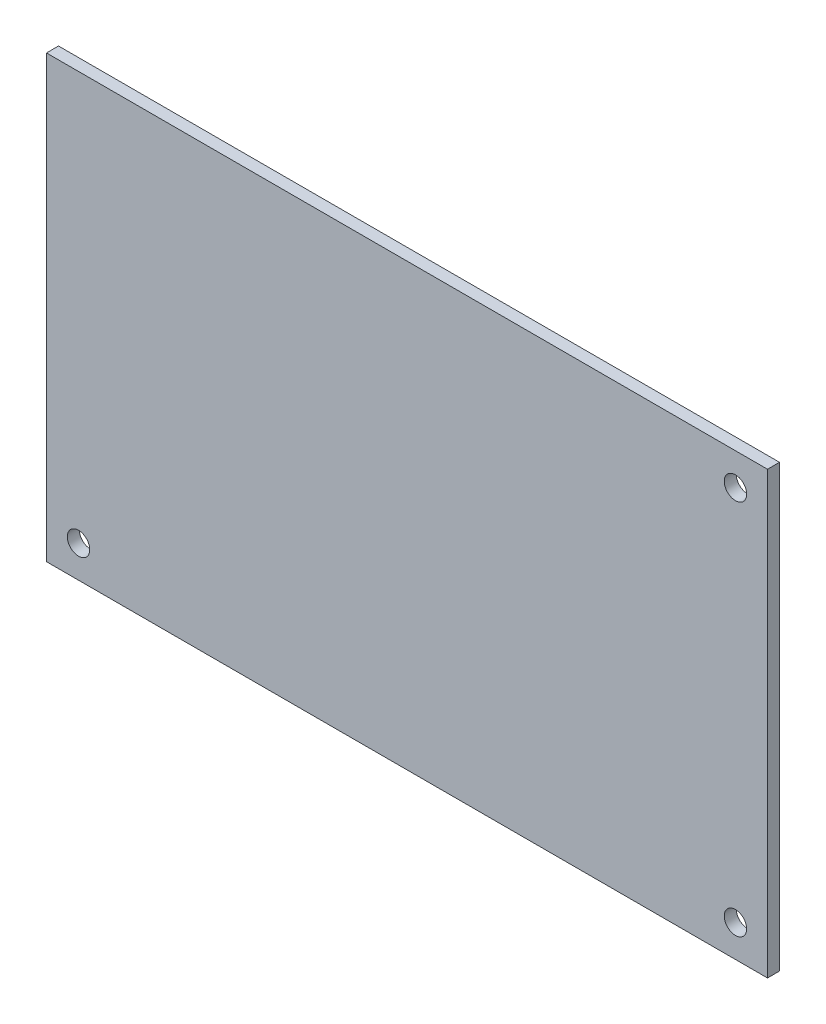
from build123d import *

# Parameters (mm, degrees)
SKETCH_1_W          = 90
SKETCH_1_H          = 55
EXTRUDE_1_DEPTH     = 1.5
SKETCH_2_R          = 1.4
CUT_EXTRUDE_1_DEPTH = 1.5


with BuildPart() as part:
    # ｽｹｯﾁ1 → ﾎﾞｽ - 押し出し1 (new body)
    with BuildSketch(Plane.XY):
        Rectangle(SKETCH_1_W, SKETCH_1_H)
    extrude(amount=EXTRUDE_1_DEPTH)

    # ｽｹｯﾁ2 → ｶｯﾄ - 押し出し1 (cut)
    with BuildSketch(Plane.XY.offset(1.5)):
        with Locations((41, -23.5)):
            Circle(SKETCH_2_R)
        with Locations((-41, -23.5)):
            Circle(SKETCH_2_R)
        with Locations((41, 23.5)):
            Circle(SKETCH_2_R)
    extrude(amount=-CUT_EXTRUDE_1_DEPTH, mode=Mode.SUBTRACT)


solid = part.part
